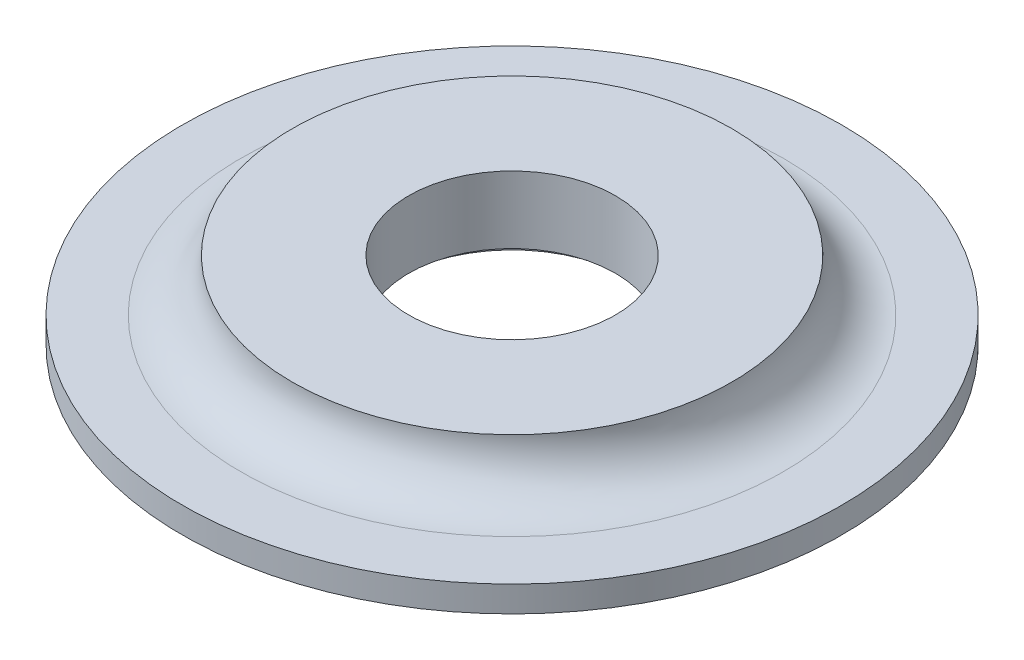
from build123d import *


with BuildPart() as part:
    # Эскиз1 → Повернуть1 (revolve)
    with BuildSketch(Plane.XY, mode=Mode.PRIVATE) as revolve_1_sk:
        with BuildLine():
            Line((9, 0), (25.5, 0))
            Line((25.5, 0), (25.5, 2))
            Line((25.5, 2), (21, 2))
            ThreePointArc((21, 2), (18.171572875, 3.171572875), (17, 6))
            Line((17, 6), (8, 6))
            Line((8, 6), (8, 0.8))
            Line((8, 0.8), (9, 0.8))
            Line((9, 0.8), (9, 0))
        make_face()
    revolve(revolve_1_sk.sketch.rotate(Axis((0, 0, 0), (0, 1, 0)), 90), axis=Axis((0, 0, 0), (0, 1, 0)))


solid = part.part
